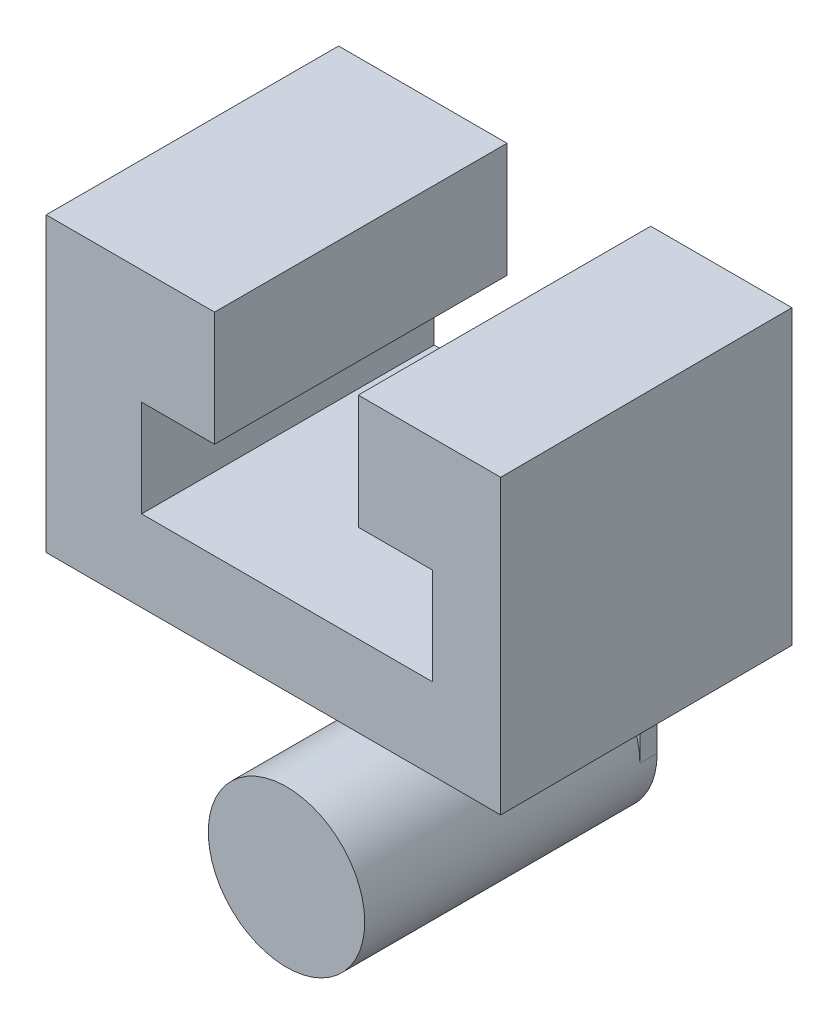
from build123d import *

# Parameters (mm, degrees)
SKETCH1_R           = 6.7945
BOSS_EXTRUDE1_DEPTH = 25.4
SKETCH2_W           = 13.589
SKETCH2_H           = 1.500538131
BOSS_EXTRUDE2_DEPTH = 13.97
BOSS_EXTRUDE3_DEPTH = 25.4
CUT_EXTRUDE1_DEPTH  = 27.94


with BuildPart() as part:
    # Sketch1 → Boss-Extrude1 (new body)
    with BuildSketch(Plane.XY):
        Circle(SKETCH1_R)
    extrude(amount=-BOSS_EXTRUDE1_DEPTH)

    # Sketch2 → Boss-Extrude2 (add)
    with BuildSketch(Plane(origin=(0, 0, 0), x_dir=(1, 0, 0), z_dir=(0, 1, 0))):
        with Locations((0, 24.649730935)):
            Rectangle(SKETCH2_W, SKETCH2_H)
    extrude(amount=BOSS_EXTRUDE2_DEPTH)

    # Sketch6 → Boss-Extrude3 (add)
    with BuildSketch(Plane(origin=(0, 13.97, 0), x_dir=(1, 0, 0), z_dir=(0, 1, 0))):
        Polygon((-20.876229987, 25.399999851), (18.493770013, 25.40000027), (18.6055, 0), (-20.876229987, 0), align=None)
    extrude(amount=BOSS_EXTRUDE3_DEPTH)

    # Sketch11 → Cut-Extrude1 (cut)
    with BuildSketch(Plane.XY):
        Polygon((0, 21.022742384), (-12.580876385, 21.022742384), (-12.580876385, 29.426569926), (-6.246648163, 29.426569926), (-6.246648163, 39.37), (0, 39.37), (6.233662889, 39.37), (6.233662889, 29.426569926), (12.693321373, 29.426569926), (12.693321373, 21.022742384), align=None)
    extrude(amount=-CUT_EXTRUDE1_DEPTH, mode=Mode.SUBTRACT)


solid = part.part
